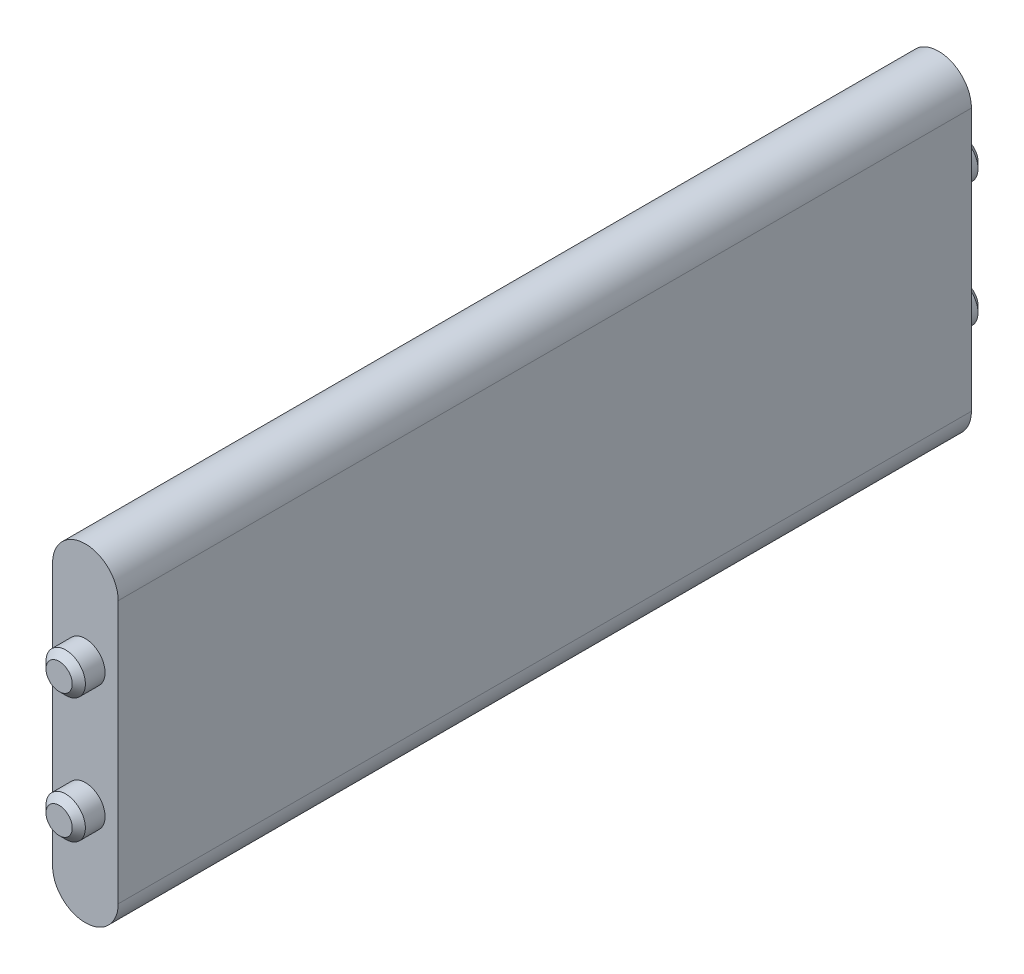
from build123d import *

# Parameters (mm, degrees)
EXTRUDE_1_DEPTH            = 65
SKETCH_2_R                 = 3
EXTRUDE_2_DEPTH            = 4
CHAMFER_1_SIZE             = 1
CHAMFER_1_OF_MIRROR_1_SIZE = 1


with BuildPart() as part:
    # 草圖1 → 伸長1 (new, symmetric)
    with BuildSketch(Plane.XY):
        with BuildLine():
            Line((-5, 20), (-5, -20))
            ThreePointArc((-5, -20), (0, -25), (5, -20))
            Line((5, -20), (5, 20))
            ThreePointArc((5, 20), (0, 25), (-5, 20))
        make_face()
    extrude(amount=EXTRUDE_1_DEPTH, both=True)

    # 草圖2 → 伸長2 (add)
    with BuildSketch(Plane.XY.offset(65)):
        with Locations(Location((0, 9.5, 0), (0, 0, 180))):
            Circle(SKETCH_2_R)
        with Locations(Location((0, -9.5, 0), (0, 0, 180))):
            Circle(SKETCH_2_R)
    extrude_2 = extrude(amount=EXTRUDE_2_DEPTH)

    # 導角1
    chamfer_1_edges = [part.edges().sort_by_distance(p)[0] for p in [
        (3, 9.5, 69),
        (3, -9.5, 69),
    ]]
    chamfer(chamfer_1_edges, length=CHAMFER_1_SIZE)

    # 鏡射1: 伸長2 across plane
    add(extrude_2.mirror(Plane.XY))

    # 導角1 of 鏡射1
    chamfer_1_of_mirror_1_edges = [part.edges().sort_by_distance(p)[0] for p in [
        (3, 9.5, -69),
        (3, -9.5, -69),
    ]]
    chamfer(chamfer_1_of_mirror_1_edges, length=CHAMFER_1_OF_MIRROR_1_SIZE)


solid = part.part
